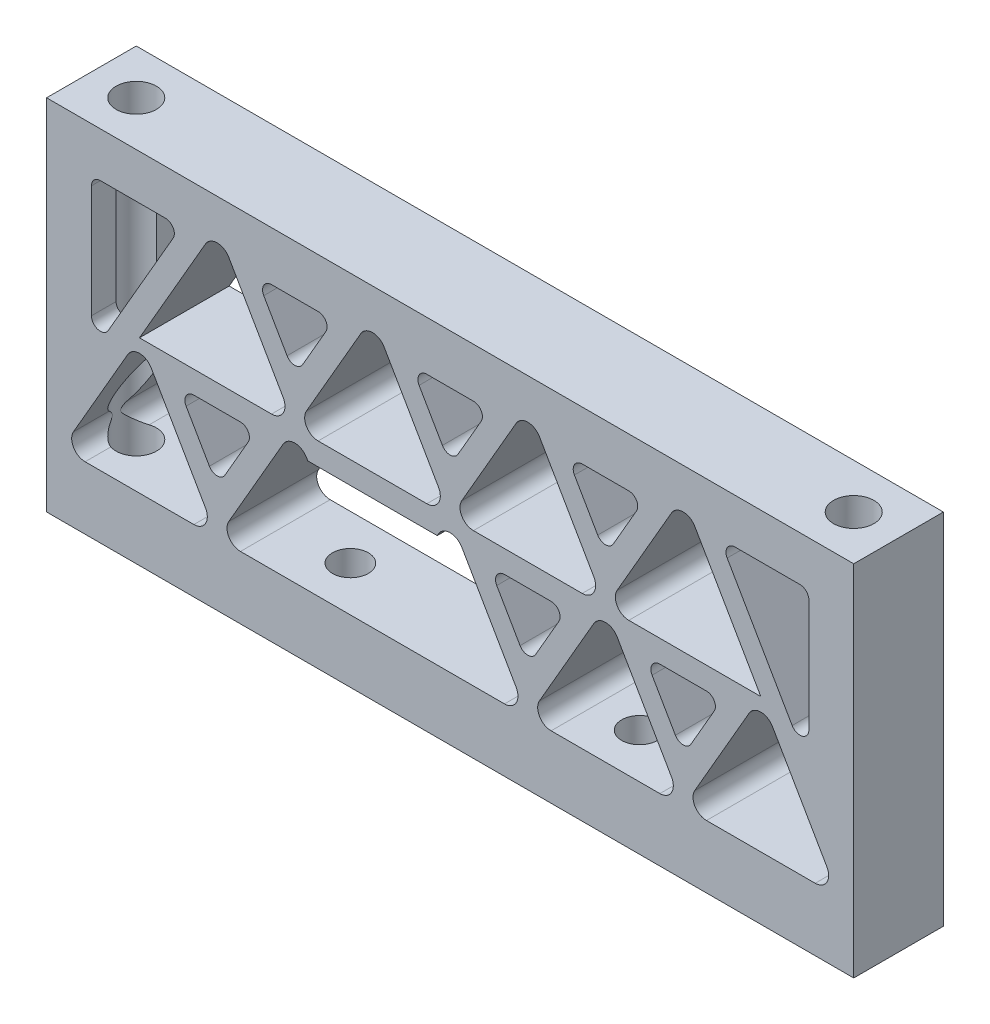
from build123d import *

# Parameters (mm, degrees)
SKETCH1_W           = 90
SKETCH1_H           = 10
BOSS_EXTRUDE1_DEPTH = 40
CUT_EXTRUDE1_DEPTH  = 99.994949366
CUT_EXTRUDE2_DEPTH  = 99.994949366
CUT_EXTRUDE3_DEPTH  = 99.994949366
CUT_EXTRUDE4_REACH  = 100.995
SKETCH5_R           = 2.25
CUT_EXTRUDE5_REACH  = 100.995
SKETCH6_R           = 2
SKETCH7_W           = 17.320508076
SKETCH7_H           = 12.5
CUT_EXTRUDE6_DEPTH  = 99.994949417


with BuildPart() as part:
    # Sketch1 → Boss-Extrude1 (new body)
    with BuildSketch(Plane(origin=(0, 0, 0), x_dir=(1, 0, 0), z_dir=(0, 1, 0))):
        with Locations((45, 5)):
            Rectangle(SKETCH1_W, SKETCH1_H)
    extrude(amount=BOSS_EXTRUDE1_DEPTH)

    # Sketch2 → Cut-Extrude1 (cut, through all)
    with BuildSketch(Plane.XY):
        with BuildLine():
            Line((26.380453819, 19.75), (20.318275992, 9.25))
            ThreePointArc((20.318275992, 9.25), (20.318275992, 7.75), (21.617314098, 7))
            Line((21.617314098, 7), (33.741669751, 7))
            ThreePointArc((33.741669751, 7), (35.040707856, 7.75), (35.040707856, 9.25))
            Line((35.040707856, 9.25), (28.97853003, 19.75))
            ThreePointArc((28.97853003, 19.75), (27.679491924, 20.5), (26.380453819, 19.75))
        make_face()
        with BuildLine():
            Line((9.059945743, 19.75), (2.997767916, 9.25))
            ThreePointArc((2.997767916, 9.25), (2.997767916, 7.75), (4.296806022, 7))
            Line((4.296806022, 7), (16.421161675, 7))
            ThreePointArc((16.421161675, 7), (17.720199781, 7.75), (17.720199781, 9.25))
            Line((17.720199781, 9.25), (11.658021954, 19.75))
            ThreePointArc((11.658021954, 19.75), (10.358983849, 20.5), (9.059945743, 19.75))
        make_face()
        with BuildLine():
            Line((43.700961894, 19.75), (37.638784068, 9.25))
            ThreePointArc((37.638784068, 9.25), (37.638784068, 7.75), (38.937822174, 7))
            Line((38.937822174, 7), (51.062177826, 7))
            ThreePointArc((51.062177826, 7), (52.361215932, 7.75), (52.361215932, 9.25))
            Line((52.361215932, 9.25), (46.299038106, 19.75))
            ThreePointArc((46.299038106, 19.75), (45, 20.5), (43.700961894, 19.75))
        make_face()
        with BuildLine():
            Line((61.02146997, 19.75), (54.959292144, 9.25))
            ThreePointArc((54.959292144, 9.25), (54.959292144, 7.75), (56.258330249, 7))
            Line((56.258330249, 7), (68.382685902, 7))
            ThreePointArc((68.382685902, 7), (69.681724008, 7.75), (69.681724008, 9.25))
            Line((69.681724008, 9.25), (63.619546181, 19.75))
            ThreePointArc((63.619546181, 19.75), (62.320508076, 20.5), (61.02146997, 19.75))
        make_face()
        with BuildLine():
            Line((78.341978046, 19.75), (72.279800219, 9.25))
            ThreePointArc((72.279800219, 9.25), (72.279800219, 7.75), (73.578838325, 7))
            Line((73.578838325, 7), (85.703193978, 7))
            ThreePointArc((85.703193978, 7), (87.002232084, 7.75), (87.002232084, 9.25))
            Line((87.002232084, 9.25), (80.940054257, 19.75))
            ThreePointArc((80.940054257, 19.75), (79.641016151, 20.5), (78.341978046, 19.75))
        make_face()
        with BuildLine():
            Line((35.040707856, 34.75), (28.97853003, 24.25))
            ThreePointArc((28.97853003, 24.25), (28.97853003, 22.75), (30.277568136, 22))
            Line((30.277568136, 22), (42.401923789, 22))
            ThreePointArc((42.401923789, 22), (43.700961894, 22.75), (43.700961894, 24.25))
            Line((43.700961894, 24.25), (37.638784068, 34.75))
            ThreePointArc((37.638784068, 34.75), (36.339745962, 35.5), (35.040707856, 34.75))
        make_face()
        with BuildLine():
            Line((17.720199781, 34.75), (10.358983849, 22))
            Line((10.358983849, 22), (25.081415713, 22))
            ThreePointArc((25.081415713, 22), (26.380453819, 22.75), (26.380453819, 24.25))
            Line((26.380453819, 24.25), (20.318275992, 34.75))
            ThreePointArc((20.318275992, 34.75), (19.019237886, 35.5), (17.720199781, 34.75))
        make_face()
        with BuildLine():
            Line((52.361215932, 34.75), (46.299038106, 24.25))
            ThreePointArc((46.299038106, 24.25), (46.299038106, 22.75), (47.598076211, 22))
            Line((47.598076211, 22), (59.722431864, 22))
            ThreePointArc((59.722431864, 22), (61.02146997, 22.75), (61.02146997, 24.25))
            Line((61.02146997, 24.25), (54.959292144, 34.75))
            ThreePointArc((54.959292144, 34.75), (53.660254038, 35.5), (52.361215932, 34.75))
        make_face()
        with BuildLine():
            Line((69.681724008, 34.75), (63.619546181, 24.25))
            ThreePointArc((63.619546181, 24.25), (63.619546181, 22.75), (64.918584287, 22))
            Line((64.918584287, 22), (79.641016151, 22))
            Line((79.641016151, 22), (72.279800219, 34.75))
            ThreePointArc((72.279800219, 34.75), (70.980762114, 35.5), (69.681724008, 34.75))
        make_face()
    extrude(amount=-CUT_EXTRUDE1_DEPTH, mode=Mode.SUBTRACT)

    # Sketch3 → Cut-Extrude2 (cut, through all)
    with BuildSketch(Plane.XY):
        with BuildLine():
            Line((19.88526329, 13.5), (22.483339502, 18))
            ThreePointArc((22.483339502, 18), (22.483339502, 19), (21.617314098, 19.5))
            Line((21.617314098, 19.5), (16.421161675, 19.5))
            ThreePointArc((16.421161675, 19.5), (15.555136271, 19), (15.555136271, 18))
            Line((15.555136271, 18), (18.153212483, 13.5))
            ThreePointArc((18.153212483, 13.5), (19.019237886, 13), (19.88526329, 13.5))
        make_face()
        with BuildLine():
            Line((37.20526329, 13.5), (39.803339502, 18))
            ThreePointArc((39.803339502, 18), (39.803339502, 19), (38.937314098, 19.5))
            Line((38.937314098, 19.5), (33.741161675, 19.5))
            ThreePointArc((33.741161675, 19.5), (32.875136271, 19), (32.875136271, 18))
            Line((32.875136271, 18), (35.473212483, 13.5))
            ThreePointArc((35.473212483, 13.5), (36.339237886, 13), (37.20526329, 13.5))
        make_face()
        with BuildLine():
            Line((54.52526329, 13.5), (57.123339502, 18))
            ThreePointArc((57.123339502, 18), (57.123339502, 19), (56.257314098, 19.5))
            Line((56.257314098, 19.5), (51.061161675, 19.5))
            ThreePointArc((51.061161675, 19.5), (50.195136271, 19), (50.195136271, 18))
            Line((50.195136271, 18), (52.793212483, 13.5))
            ThreePointArc((52.793212483, 13.5), (53.659237886, 13), (54.52526329, 13.5))
        make_face()
        with BuildLine():
            Line((71.84526329, 13.5), (74.443339502, 18))
            ThreePointArc((74.443339502, 18), (74.443339502, 19), (73.577314098, 19.5))
            Line((73.577314098, 19.5), (68.381161675, 19.5))
            ThreePointArc((68.381161675, 19.5), (67.515136271, 19), (67.515136271, 18))
            Line((67.515136271, 18), (70.113212483, 13.5))
            ThreePointArc((70.113212483, 13.5), (70.979237886, 13), (71.84526329, 13.5))
        make_face()
        with BuildLine():
            Line((28.545517328, 28.5), (31.143593539, 33))
            ThreePointArc((31.143593539, 33), (31.143593539, 34), (30.277568136, 34.5))
            Line((30.277568136, 34.5), (25.081415713, 34.5))
            ThreePointArc((25.081415713, 34.5), (24.215390309, 34), (24.215390309, 33))
            Line((24.215390309, 33), (26.813466521, 28.5))
            ThreePointArc((26.813466521, 28.5), (27.679491924, 28), (28.545517328, 28.5))
        make_face()
        with BuildLine():
            Line((45.865517328, 28.5), (48.463593539, 33))
            ThreePointArc((48.463593539, 33), (48.463593539, 34), (47.597568136, 34.5))
            Line((47.597568136, 34.5), (42.401415713, 34.5))
            ThreePointArc((42.401415713, 34.5), (41.535390309, 34), (41.535390309, 33))
            Line((41.535390309, 33), (44.133466521, 28.5))
            ThreePointArc((44.133466521, 28.5), (44.999491924, 28), (45.865517328, 28.5))
        make_face()
        with BuildLine():
            Line((63.185517328, 28.5), (65.783593539, 33))
            ThreePointArc((65.783593539, 33), (65.783593539, 34), (64.917568136, 34.5))
            Line((64.917568136, 34.5), (59.721415713, 34.5))
            ThreePointArc((59.721415713, 34.5), (58.855390309, 34), (58.855390309, 33))
            Line((58.855390309, 33), (61.453466521, 28.5))
            ThreePointArc((61.453466521, 28.5), (62.319491924, 28), (63.185517328, 28.5))
        make_face()
    extrude(amount=-CUT_EXTRUDE2_DEPTH, mode=Mode.SUBTRACT)

    # Sketch4 → Cut-Extrude3 (cut, through all)
    with BuildSketch(Plane.XY):
        with BuildLine():
            Line((5, 21.450018505), (5, 34))
            ThreePointArc((5, 34), (5.292893219, 34.707106781), (6, 35))
            Line((6, 35), (13.245735195, 35))
            ThreePointArc((13.245735195, 35), (14.111760598, 34.5), (14.111760598, 33.5))
            Line((14.111760598, 33.5), (6.866025404, 20.950018505))
            ThreePointArc((6.866025404, 20.950018505), (5.741180955, 20.484092679), (5, 21.450018505))
        make_face()
        with BuildLine():
            Line((84, 35), (76.754264805, 35))
            ThreePointArc((76.754264805, 35), (75.888239402, 34.5), (75.888239402, 33.5))
            Line((75.888239402, 33.5), (83.133974596, 20.950018505))
            ThreePointArc((83.133974596, 20.950018505), (84.258819045, 20.484092679), (85, 21.450018505))
            Line((85, 21.450018505), (85, 34))
            ThreePointArc((85, 34), (84.707106781, 34.707106781), (84, 35))
        make_face()
    extrude(amount=-CUT_EXTRUDE3_DEPTH, mode=Mode.SUBTRACT)

    # Sketch5 → Cut-Extrude4 (cut, up to next)
    with BuildSketch(Plane(origin=(0, 40, 0), x_dir=(1, 0, 0), z_dir=(0, 1, 0)), mode=Mode.PRIVATE) as cut_extrude4_sk1:
        with Locations(Location((5, 5, 0), (0, 0, 270))):
            Circle(SKETCH5_R)
    cut_extrude4_tool1 = extrude(cut_extrude4_sk1.sketch, amount=-CUT_EXTRUDE4_REACH, mode=Mode.PRIVATE) & part.part
    # Sketch5 → Cut-Extrude4 (cut, up to next)
    with BuildSketch(Plane(origin=(0, 40, 0), x_dir=(1, 0, 0), z_dir=(0, 1, 0)), mode=Mode.PRIVATE) as cut_extrude4_sk2:
        with Locations(Location((85, 5, 0), (0, 0, 270))):
            Circle(SKETCH5_R)
    cut_extrude4_tool2 = extrude(cut_extrude4_sk2.sketch, amount=-CUT_EXTRUDE4_REACH, mode=Mode.PRIVATE) & part.part
    add(cut_extrude4_tool1.solids().sort_by_distance((5, 40, -5))[0], mode=Mode.SUBTRACT)
    add(cut_extrude4_tool2.solids().sort_by_distance((85, 40, -5))[0], mode=Mode.SUBTRACT)

    # Sketch6 → Cut-Extrude5 (cut, up to next)
    with BuildSketch(Plane.XZ, mode=Mode.PRIVATE) as cut_extrude5_sk1:
        with Locations(Location((28.875, -5, 0), (0, 0, 270))):
            Circle(SKETCH6_R)
    cut_extrude5_tool1 = extrude(cut_extrude5_sk1.sketch, amount=-CUT_EXTRUDE5_REACH, mode=Mode.PRIVATE) & part.part
    # Sketch6 → Cut-Extrude5 (cut, up to next)
    with BuildSketch(Plane.XZ, mode=Mode.PRIVATE) as cut_extrude5_sk2:
        with Locations(Location((61.125, -5, 0), (0, 0, 270))):
            Circle(SKETCH6_R)
    cut_extrude5_tool2 = extrude(cut_extrude5_sk2.sketch, amount=-CUT_EXTRUDE5_REACH, mode=Mode.PRIVATE) & part.part
    add(cut_extrude5_tool1.solids().sort_by_distance((28.875, 0, -5))[0], mode=Mode.SUBTRACT)
    add(cut_extrude5_tool2.solids().sort_by_distance((61.125, 0, -5))[0], mode=Mode.SUBTRACT)

    # Sketch7 → Cut-Extrude6 (cut, through all)
    with BuildSketch(Plane.XY):
        with Locations((36.339745962, 13.25)):
            Rectangle(SKETCH7_W, SKETCH7_H)
    extrude(amount=-CUT_EXTRUDE6_DEPTH, mode=Mode.SUBTRACT)


solid = part.part
